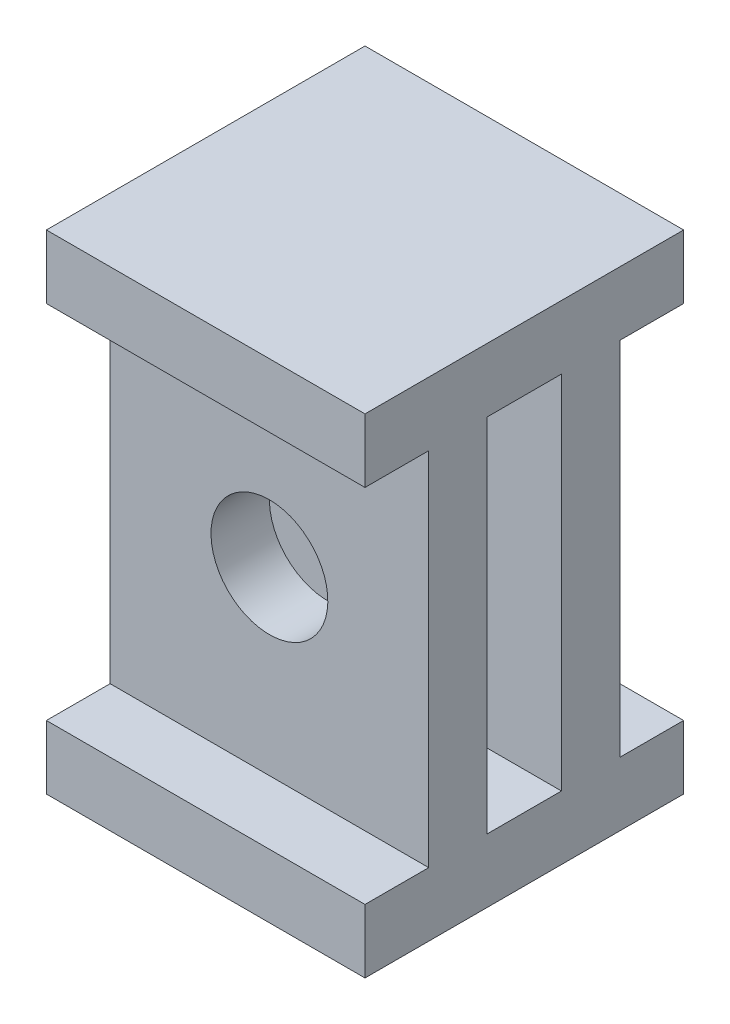
from build123d import *

# Parameters (mm, degrees)
SKETCH1_W           = 15
SKETCH1_H           = 7.5
BOSS_EXTRUDE1_DEPTH = 23
SKETCH10_W          = 3
SKETCH10_H          = 17
SKETCH10_W_2        = 3.5
CUT_EXTRUDE5_DEPTH  = 29.464890655
SKETCH11_R          = 2.75
CUT_EXTRUDE6_DEPTH  = 30.966648128


with BuildPart() as part:
    # Sketch1 → Boss-Extrude1 (new body)
    with BuildSketch(Plane(origin=(0, 0, 0), x_dir=(1, 0, 0), z_dir=(0, 1, 0))):
        with Locations((7.5, 3.75)):
            Rectangle(SKETCH1_W, SKETCH1_H)
    extrude(amount=BOSS_EXTRUDE1_DEPTH)

    # Mirror1: part across plane


with BuildPart() as part_1:
    add(part.part)
    add(part.part.mirror(Plane(origin=(0, 23, 0), x_dir=(1, 0, 0), z_dir=(0, 0, -1))))

    # Sketch10 → Cut-Extrude5 (cut, through all)
    with BuildSketch(Plane(origin=(15, 0, 0), x_dir=(0, 0, -1), z_dir=(1, 0, 0))):
        with Locations((-6, 11.5)):
            Rectangle(SKETCH10_W, SKETCH10_H)
        with Locations((6, 11.5)):
            Rectangle(SKETCH10_W, SKETCH10_H)
        with Locations((0, 11.5)):
            Rectangle(SKETCH10_W_2, SKETCH10_H)
    extrude(amount=-CUT_EXTRUDE5_DEPTH, mode=Mode.SUBTRACT)

    # Sketch11 → Cut-Extrude6 (cut, through all)
    with BuildSketch(Plane(origin=(0, 0, -4.5), x_dir=(-1, 0, 0), z_dir=(0, 0, -1))):
        with Locations(Location((-7.5, 11.5, 0), (0, 0, 90))):
            Circle(SKETCH11_R)
    extrude(amount=-CUT_EXTRUDE6_DEPTH, mode=Mode.SUBTRACT)


solid = part_1.part
